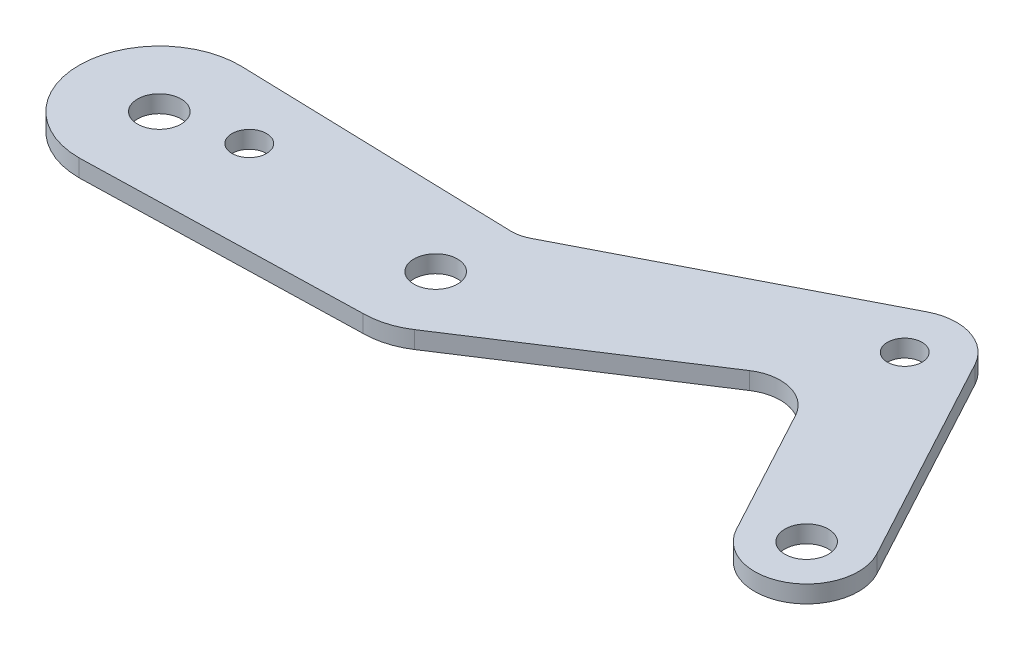
from build123d import *

# Parameters (mm, degrees)
SKETCH1_R           = 4.0005
SKETCH1_R_2         = 3.175
BOSS_EXTRUDE1_DEPTH = 3.175


with BuildPart() as part:
    # Sketch1 → Boss-Extrude1 (new body)
    with BuildSketch(Plane(origin=(0, 0, 0), x_dir=(1, 0, 0), z_dir=(0, 1, 0))):
        with BuildLine():
            ThreePointArc((-46.902498527, 23.246309683), (-62.059272503, 8.733659936), (-47.328815007, -6.211520625))
            Line((-47.328815007, -6.211520625), (-46.561465221, -6.19152247))
            Line((-46.561465221, -6.19152247), (3.471132419, -4.887606539))
            ThreePointArc((3.471132419, -4.887606539), (7.262671761, -4.337224423), (10.741230908, -2.731510464))
            Line((10.741230908, -2.731510464), (48.038745416, 21.524588854))
            ThreePointArc((48.038745416, 21.524588854), (54.329351234, 22.561375589), (59.353430379, 18.636419917))
            Line((59.353430379, 18.636419917), (72.07389053, -4.964849275))
            ThreePointArc((72.07389053, -4.964849275), (84.979781777, -8.82930009), (88.84104895, 4.077544017))
            Line((88.84104895, 4.077544017), (67.73364895, 43.193544017))
            ThreePointArc((67.73364895, 43.193544017), (62.173939186, 47.767404403), (55.001620384, 47.144175333))
            Line((55.001620384, 47.144175333), (6.940489179, 22.474885504))
            ThreePointArc((6.940489179, 22.474885504), (5.442894785, 21.93088115), (3.857022336, 21.776808826))
            Line((3.857022336, 21.776808826), (-46.902498527, 23.246309683))
        make_face()
        with Locations(Location((-47.328815007, 8.520479375, 0), (0, 0, 270))):
            Circle(SKETCH1_R, mode=Mode.SUBTRACT)
        with Locations(Location((-33.993815007, 11.695479375, 0), (0, 0, 270))):
            Circle(SKETCH1_R_2, mode=Mode.SUBTRACT)
        with Locations(Location((3.471132419, 8.447393461, 0), (0, 0, 270))):
            Circle(SKETCH1_R, mode=Mode.SUBTRACT)
        with Locations(Location((80.458584993, -0.445720625, 0), (0, 0, 270))):
            Circle(SKETCH1_R, mode=Mode.SUBTRACT)
        with Locations(Location((59.351184993, 38.670279375, 0), (0, 0, 270))):
            Circle(SKETCH1_R_2, mode=Mode.SUBTRACT)
    extrude(amount=-BOSS_EXTRUDE1_DEPTH)


solid = part.part
